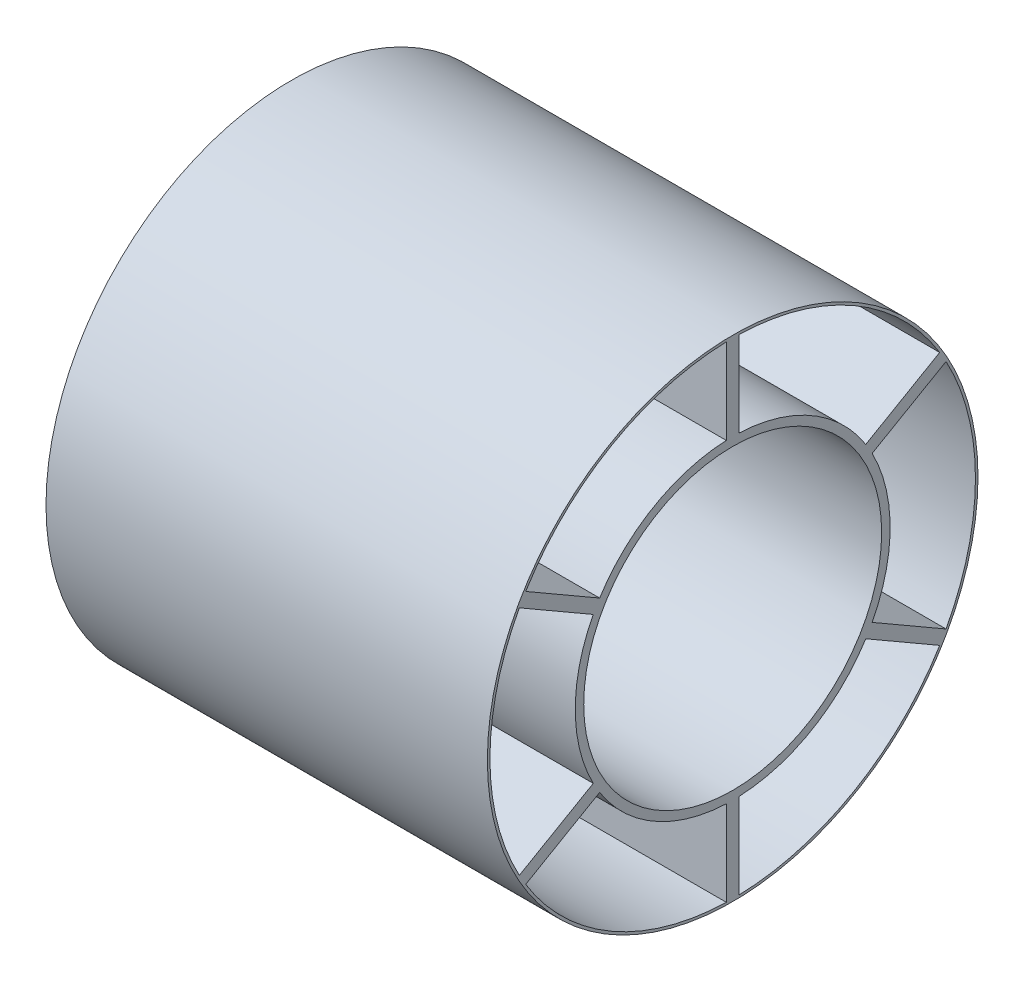
from build123d import *

# Parameters (mm, degrees)
CROQUIS1_R              = 28.9
CROQUIS1_R_2            = 28.6
SALIENTE_EXTRUIR1_DEPTH = 52
CROQUIS2_R              = 17.55
SALIENTE_EXTRUIR2_DEPTH = 52
CROQUIS3_R              = 17.55
CROQUIS3_R_2            = 15
SALIENTE_EXTRUIR3_DEPTH = 2
CROQUIS4_OUTSIDE_W      = 79.374
CROQUIS4_OUTSIDE_H      = 81.026
CROQUIS4_OUTSIDE_R      = 28.9
CORTAR_EXTRUIR1_DEPTH   = 100


with BuildPart() as part:
    # Croquis1 → Saliente-Extruir1 (new body)
    with BuildSketch(Plane(origin=(0, 0, 0), x_dir=(0, 0, -1), z_dir=(1, 0, 0))):
        with Locations(Location((0, 0, 0), (0, 0, 180))):
            Circle(CROQUIS1_R)
        with Locations(Location((0, 0, 0), (0, 0, 180))):
            Circle(CROQUIS1_R_2, mode=Mode.SUBTRACT)
    extrude(amount=SALIENTE_EXTRUIR1_DEPTH)

    # Croquis2 → Saliente-Extruir2 (add)
    with BuildSketch(Plane.ZY):
        with BuildLine():
            Line((-15.676635431, 9.91693509), (-25.360087572, 15.50767879))
            ThreePointArc((-25.360087572, 15.50767879), (-25.743282761, 14.862891232), (-26.110087572, 14.208640684))
            Line((-26.110087572, 14.208640684), (-16.426635431, 8.617896984))
            ThreePointArc((-16.426635431, 8.617896984), (-18.55, 0), (-16.426635431, -8.617896984))
            Line((-16.426635431, -8.617896984), (-26.110087572, -14.208640684))
            ThreePointArc((-26.110087572, -14.208640684), (-25.743282761, -14.862891232), (-25.360087572, -15.50767879))
            Line((-25.360087572, -15.50767879), (-15.676635431, -9.91693509))
            ThreePointArc((-15.676635431, -9.91693509), (-9.275, -16.06477124), (-0.75, -18.534832074))
            Line((-0.75, -18.534832074), (-0.75, -29.716319474))
            ThreePointArc((-0.75, -29.716319474), (0, -29.725782464), (0.75, -29.716319474))
            Line((0.75, -29.716319474), (0.75, -18.534832074))
            ThreePointArc((0.75, -18.534832074), (9.275, -16.06477124), (15.676635431, -9.91693509))
            Line((15.676635431, -9.91693509), (25.360087572, -15.50767879))
            ThreePointArc((25.360087572, -15.50767879), (25.743282761, -14.862891232), (26.110087572, -14.208640684))
            Line((26.110087572, -14.208640684), (16.426635431, -8.617896984))
            ThreePointArc((16.426635431, -8.617896984), (18.55, 0), (16.426635431, 8.617896984))
            Line((16.426635431, 8.617896984), (26.110087572, 14.208640684))
            ThreePointArc((26.110087572, 14.208640684), (25.743282761, 14.862891232), (25.360087572, 15.50767879))
            Line((25.360087572, 15.50767879), (15.676635431, 9.91693509))
            ThreePointArc((15.676635431, 9.91693509), (9.275, 16.06477124), (0.75, 18.534832074))
            Line((0.75, 18.534832074), (0.75, 29.716319474))
            ThreePointArc((0.75, 29.716319474), (0, 29.725782464), (-0.75, 29.716319474))
            Line((-0.75, 29.716319474), (-0.75, 18.534832074))
            ThreePointArc((-0.75, 18.534832074), (-9.275, 16.06477124), (-15.676635431, 9.91693509))
        make_face()
        Circle(CROQUIS2_R, mode=Mode.SUBTRACT)
    extrude(amount=-SALIENTE_EXTRUIR2_DEPTH)

    # Croquis3 → Saliente-Extruir3 (add)
    with BuildSketch(Plane.ZY):
        Circle(CROQUIS3_R)
        Circle(CROQUIS3_R_2, mode=Mode.SUBTRACT)
    extrude(amount=-SALIENTE_EXTRUIR3_DEPTH)

    # Croquis4 outside → Cortar-Extruir1 (cut)
    with BuildSketch(Plane(origin=(52, 0, 0), x_dir=(0, 0, -1), z_dir=(1, 0, 0))):
        Rectangle(CROQUIS4_OUTSIDE_W, CROQUIS4_OUTSIDE_H)
        with Locations(Location((0, 0, 0), (0, 0, 180))):
            Circle(CROQUIS4_OUTSIDE_R, mode=Mode.SUBTRACT)
    extrude(amount=-CORTAR_EXTRUIR1_DEPTH, mode=Mode.SUBTRACT)


solid = part.part
